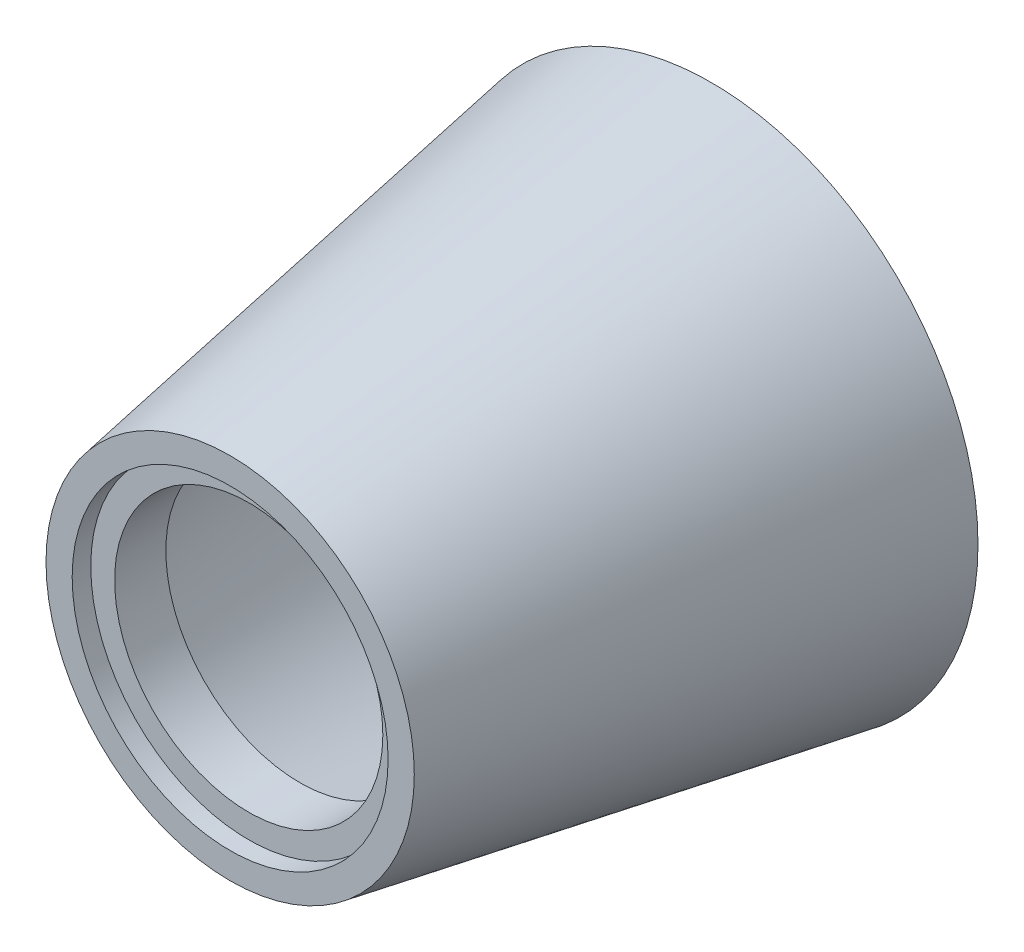
from build123d import *


with BuildPart() as part:
    # Sketch1 → Revolve1 (revolve)
    with BuildSketch(Plane(origin=(0, 0, 0), x_dir=(0, 0, -1), z_dir=(1, 0, 0)), mode=Mode.PRIVATE) as revolve1_sk:
        Polygon((-74.79575879, 72.158845464), (-74.79575879, 85), (-84.79575879, 85), (-84.79575879, 99.083589386), (174.114088383, 143.490018022), (174.114088383, 121.286803704), (-47.242788961, 83.321201065), (-47.242788961, 72.158845464), align=None)
    revolve(revolve1_sk.sketch.rotate(Axis((0, 0, 108.406367075), (0, 0, -1)), 90), axis=Axis((0, 0, 108.406367075), (0, 0, -1)))


solid = part.part
